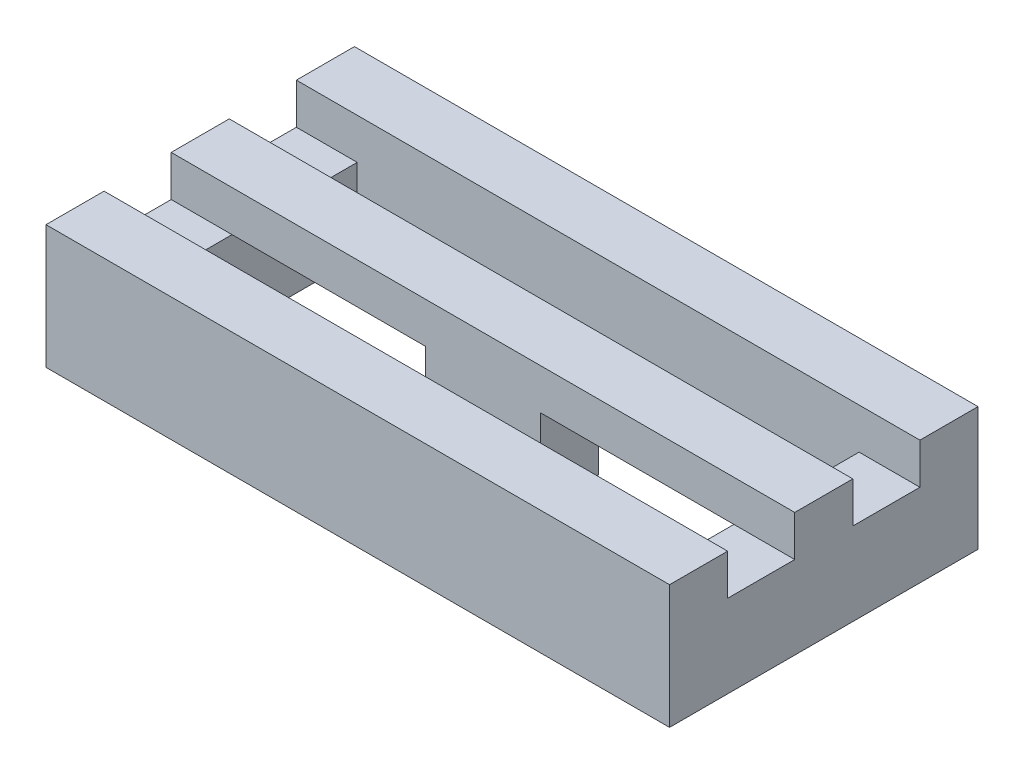
from build123d import *

# Parameters (mm, degrees)
SKETCH1_W           = 15.89
SKETCH1_H           = 7.86
BOSS_EXTRUDE1_DEPTH = 3.15
SKETCH2_W           = 1.71
SKETCH2_H           = 1.04
CUT_EXTRUDE1_DEPTH  = 17.669118153
SKETCH3_W           = 12.79
SKETCH3_H           = 1.71
CUT_EXTRUDE2_DEPTH  = 10.111532528
SKETCH4_W           = 4.93
SKETCH4_H           = 2.11
CUT_EXTRUDE3_DEPTH  = 1.6


with BuildPart() as part:
    # Sketch1 → Boss-Extrude1 (new body)
    with BuildSketch(Plane(origin=(0, 0, 0), x_dir=(1, 0, 0), z_dir=(0, 1, 0))):
        Rectangle(SKETCH1_W, SKETCH1_H)
    extrude(amount=-BOSS_EXTRUDE1_DEPTH)

    # Sketch2 → Cut-Extrude1 (cut, through all)
    with BuildSketch(Plane(origin=(7.945, 0, 0), x_dir=(0, 0, -1), z_dir=(1, 0, 0))):
        with Locations((1.595, -0.52)):
            Rectangle(SKETCH2_W, SKETCH2_H)
        with Locations((-1.595, -0.52)):
            Rectangle(SKETCH2_W, SKETCH2_H)
    extrude(amount=-CUT_EXTRUDE1_DEPTH, mode=Mode.SUBTRACT)

    # Sketch3 → Cut-Extrude2 (cut, through all)
    with BuildSketch(Plane(origin=(0, -1.04, 0), x_dir=(1, 0, 0), z_dir=(0, 1, 0))):
        with Locations((0, 1.595)):
            Rectangle(SKETCH3_W, SKETCH3_H)
        with Locations((0, -1.595)):
            Rectangle(SKETCH3_W, SKETCH3_H)
    extrude(amount=-CUT_EXTRUDE2_DEPTH, mode=Mode.SUBTRACT)

    # Sketch4 → Cut-Extrude3 (cut)
    with BuildSketch(Plane.XY.offset(0.74)):
        with Locations((-3.93, -2.095)):
            Rectangle(SKETCH4_W, SKETCH4_H)
        with Locations((3.93, -2.095)):
            Rectangle(SKETCH4_W, SKETCH4_H)
    extrude(amount=-CUT_EXTRUDE3_DEPTH, mode=Mode.SUBTRACT)


solid = part.part
